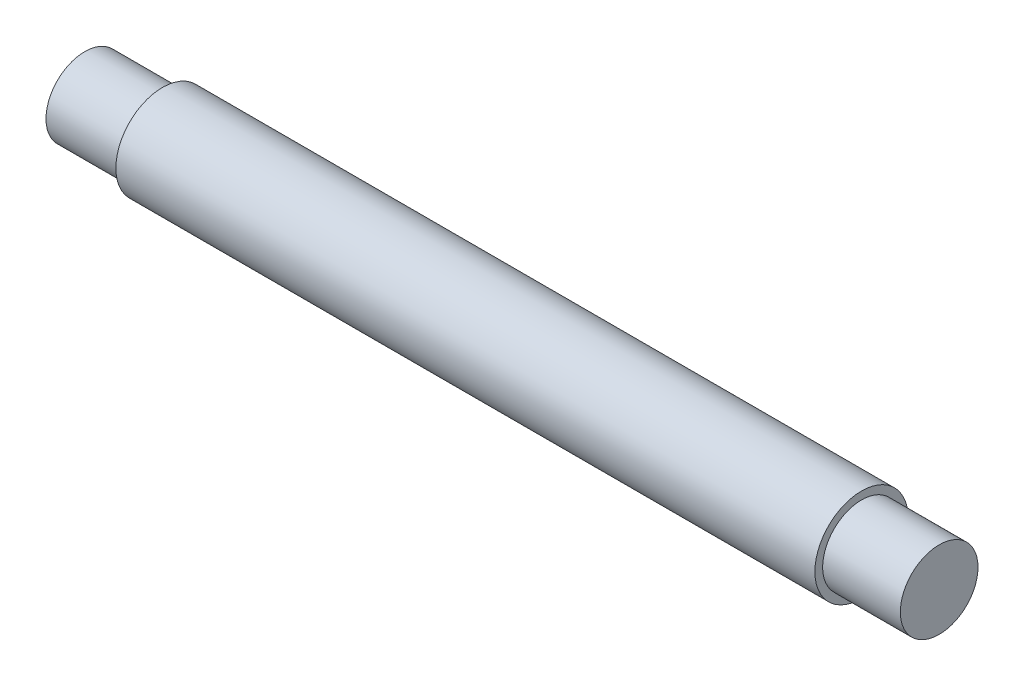
from build123d import *

# Parameters (mm, degrees)
SKETCH1_R           = 6
BOSS_EXTRUDE1_DEPTH = 110
SKETCH2_OUTSIDE_W   = 36.26
SKETCH2_OUTSIDE_H   = 36.26
SKETCH2_OUTSIDE_R   = 5
CUT_EXTRUDE1_DEPTH  = 10
SKETCH3_OUTSIDE_W   = 36.26
SKETCH3_OUTSIDE_H   = 36.26
SKETCH3_OUTSIDE_R   = 5
CUT_EXTRUDE2_DEPTH  = 10


with BuildPart() as part:
    # Sketch1 → Boss-Extrude1 (new body)
    with BuildSketch(Plane(origin=(0, 0, 0), x_dir=(0, 0, -1), z_dir=(1, 0, 0))):
        Circle(SKETCH1_R)
    extrude(amount=BOSS_EXTRUDE1_DEPTH)

    # Sketch2 outside → Cut-Extrude1 (cut)
    with BuildSketch(Plane(origin=(110, 0, 0), x_dir=(0, 0, -1), z_dir=(1, 0, 0))):
        Rectangle(SKETCH2_OUTSIDE_W, SKETCH2_OUTSIDE_H)
        Circle(SKETCH2_OUTSIDE_R, mode=Mode.SUBTRACT)
    extrude(amount=-CUT_EXTRUDE1_DEPTH, mode=Mode.SUBTRACT)

    # Sketch3 outside → Cut-Extrude2 (cut)
    with BuildSketch(Plane.ZY):
        Rectangle(SKETCH3_OUTSIDE_W, SKETCH3_OUTSIDE_H)
        with Locations(Location((0, 0, 0), (0, 0, 180))):
            Circle(SKETCH3_OUTSIDE_R, mode=Mode.SUBTRACT)
    extrude(amount=-CUT_EXTRUDE2_DEPTH, mode=Mode.SUBTRACT)


solid = part.part
